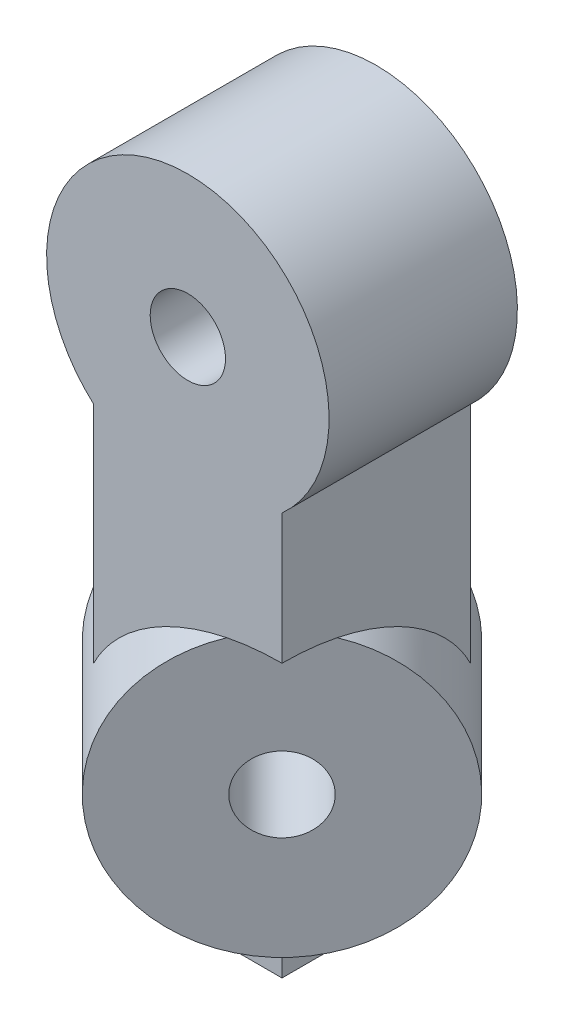
from build123d import *

# Parameters (mm, degrees)
SKETCH1_R               = 1.5
BOSS_EXTRUDE1_DEPTH     = 10
SKETCH2_R               = 2
CUT_EXTRUDE1_DEPTH      = 30
SKETCH6_R               = 7.5
BOSS_EXTRUDE3_DEPTH     = 5
CUT_EXTRUDE4_DEPTH      = 26.013853674
CUT_EXTRUDE4_DEPTH_BACK = 26.013853674
SKETCH7_R               = 1.5
SKETCH8_R               = 2
CUT_EXTRUDE5_DEPTH      = 18
SKETCH10_R              = 7.5
CUT_EXTRUDE7_DEPTH      = 9
SKETCH11_W              = 4
SKETCH11_H              = 4
BOSS_EXTRUDE4_DEPTH     = 2.5


with BuildPart() as part:
    # Sketch1 → Boss-Extrude1 (new body)
    with BuildSketch(Plane.XY):
        with BuildLine():
            Line((5.026455026, -10.023549892), (-4.973544974, -10.023549892))
            Line((-4.973544974, -10.023549892), (-4.973544974, 4.386280164))
            ThreePointArc((-4.973544974, 4.386280164), (0.026455026, 17.476450108), (5.026455026, 4.386280164))
            Line((5.026455026, 4.386280164), (5.026455026, -10.023549892))
        make_face()
        with Locations((0.026455026, 9.976450108)):
            Circle(SKETCH1_R, mode=Mode.SUBTRACT)
    extrude(amount=BOSS_EXTRUDE1_DEPTH)

    # Sketch2 → Cut-Extrude1 (cut)
    with BuildSketch(Plane(origin=(0, 0, 0), x_dir=(-1, 0, 0), z_dir=(0, 0, -1))):
        with Locations((-0.026455026, 9.976450108)):
            Circle(SKETCH2_R)
    extrude(amount=-CUT_EXTRUDE1_DEPTH, mode=Mode.SUBTRACT)

    # Sketch6 → Boss-Extrude3 (add, symmetric)
    with BuildSketch(Plane(origin=(2.513227513, 0, 2.513227513), x_dir=(-0.7071067811865477, 0, 0.7071067811865475), z_dir=(-0.7071067811865475, 0, -0.7071067811865477))):
        with Locations((3.516827377, -10.023549892)):
            Circle(SKETCH6_R)
    extrude(amount=BOSS_EXTRUDE3_DEPTH, both=True)

    # Sketch7 → Cut-Extrude4 (cut, two sides: drawn at the far end of the back side and taken through both)
    with BuildSketch(Plane(origin=(-1.022306393, 0, -1.022306393), x_dir=(-0.7071067811865476, 0, 0.7071067811865476), z_dir=(-0.7071067811865476, 0, -0.7071067811865476)).offset(-CUT_EXTRUDE4_DEPTH_BACK)):
        with Locations((3.516827377, -10.023549892)):
            Circle(SKETCH7_R)
    extrude(amount=CUT_EXTRUDE4_DEPTH + CUT_EXTRUDE4_DEPTH_BACK, mode=Mode.SUBTRACT)

    # Sketch8 → Cut-Extrude5 (cut, symmetric)
    with BuildSketch(Plane(origin=(-1.022306393, 0, -1.022306393), x_dir=(-0.7071067811865476, 0, 0.7071067811865476), z_dir=(-0.7071067811865476, 0, -0.7071067811865476))):
        with Locations((3.516827377, -10.023549892)):
            Circle(SKETCH8_R)
    extrude(amount=CUT_EXTRUDE5_DEPTH, both=True, mode=Mode.SUBTRACT)

    # Sketch10 → Cut-Extrude7 (cut)
    with BuildSketch(Plane(origin=(6.048761419, 0, 6.048761419), x_dir=(0.7071067811865476, 0, -0.7071067811865476), z_dir=(0.7071067811865476, 0, 0.7071067811865476))):
        with Locations((-3.516827377, -10.023549892)):
            Circle(SKETCH10_R)
    cut_extrude7 = extrude(amount=CUT_EXTRUDE7_DEPTH, mode=Mode.SUBTRACT)

    # Mirror1: Cut-Extrude7 across plane
    add(cut_extrude7.mirror(Plane(origin=(2.513227513, 0, 2.513227513), x_dir=(-0.7071067811865478, 0, 0.7071067811865472), z_dir=(-0.7071067811865475, 0, -0.7071067811865477))), mode=Mode.SUBTRACT)

    # Sketch11 → Boss-Extrude4 (add, symmetric)
    with BuildSketch(Plane(origin=(0, -17.5, 0), x_dir=(1, 0, 0), z_dir=(0, 1, 0))):
        with Locations((0.026455026, -5)):
            Rectangle(SKETCH11_W, SKETCH11_H)
    extrude(amount=BOSS_EXTRUDE4_DEPTH, both=True)


solid = part.part
